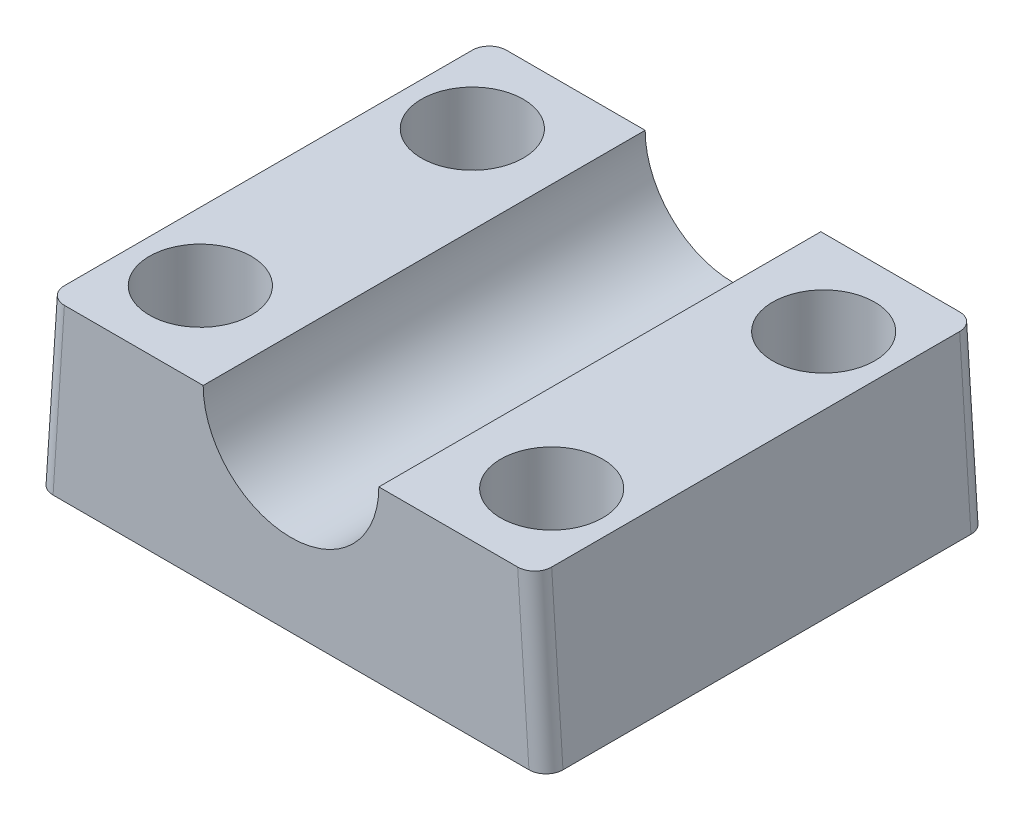
from build123d import *

# Parameters (mm, degrees)
ESTRUSIONE_ESTRUSIONE1_DEPTH = 39
FORO_PER_VITE_M8_1_D         = 9
FORO_PER_VITE_M8_1_DEPTH     = 30
FORO_PER_VITE_M8_1_TIP       = 2.703872786
RACCORDO1_R                  = 1.5


with BuildPart() as part:
    # Schizzo1 → Estrusione-Estrusione1 (new body)
    with BuildSketch(Plane.XY):
        with BuildLine():
            Line((-7.75, 15), (-21.5, 15))
            Line((-21.5, 15), (-22.5, 0))
            Line((-22.5, 0), (22.5, 0))
            Line((22.5, 0), (21.5, 15))
            Line((21.5, 15), (7.75, 15))
            ThreePointArc((7.75, 15), (0, 7.25), (-7.75, 15))
        make_face()
    extrude(amount=ESTRUSIONE_ESTRUSIONE1_DEPTH)

    # Foro per Vite M8-1
    with Locations(Plane(origin=(0, 0, 0), x_dir=(-1, 0, 0), z_dir=(0, -1, 0))):
        with Locations((-15.5, -7.5), (15.5, -7.5), (15.5, -31.5), (-15.5, -31.5)):
            Hole(FORO_PER_VITE_M8_1_D / 2, depth=FORO_PER_VITE_M8_1_DEPTH)
            with Locations((0, 0, -(FORO_PER_VITE_M8_1_DEPTH + FORO_PER_VITE_M8_1_TIP / 2))):  # 118° drill point
                Cone(0, FORO_PER_VITE_M8_1_D / 2, FORO_PER_VITE_M8_1_TIP, mode=Mode.SUBTRACT)

    # Raccordo1
    raccordo1_edges = [part.edges().sort_by_distance(p)[0] for p in [
        (-22, 7.5, 39),
        (22, 7.5, 39),
        (22, 7.5, 0),
        (-22, 7.5, 0),
    ]]
    fillet(raccordo1_edges, radius=RACCORDO1_R)


solid = part.part
